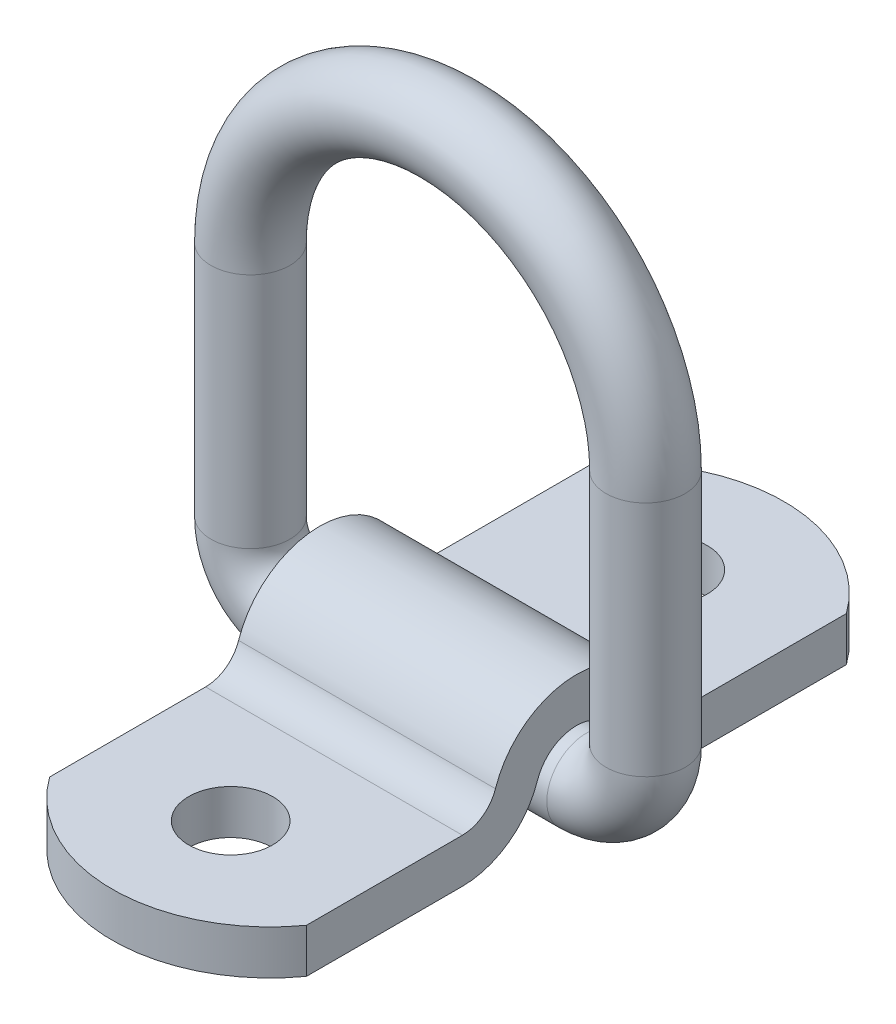
from build123d import *

# Parameters (mm, degrees)
SKETCH2_R           = 3.175
BOSS_EXTRUDE1_DEPTH = 10.31875
SKETCH4_R           = 3.3734375
CUT_EXTRUDE1_DEPTH  = 57.766087848


with BuildPart() as part:
    # Sweep1: sweep along a path in Sketch1
    with BuildLine(Plane.XY) as sweep1_path:
        Line((-15.875, 23.8125), (-15.875, 4.7625))
        ThreePointArc((-15.875, 4.7625), (-14.480096045, 1.394903955), (-11.1125, 0))
        Line((-11.1125, 0), (11.1125, 0))
        ThreePointArc((11.1125, 0), (14.480096045, 1.394903955), (15.875, 4.7625))
        Line((15.875, 4.7625), (15.875, 23.8125))
        ThreePointArc((15.875, 23.8125), (0, 39.6875), (-15.875, 23.8125))
    # Sketch2 → Sweep1 (sweep)
    with BuildSketch(Plane(origin=(0, 0, 0), x_dir=(0, 0, -1), z_dir=(1, 0, 0))):
        Circle(SKETCH2_R)
    sweep(path=sweep1_path.line)


with BuildPart() as body_2:
    # Sketch3 → Boss-Extrude1 (new, symmetric)
    with BuildSketch(Plane(origin=(0, 0, 0), x_dir=(0, 0, -1), z_dir=(1, 0, 0))):
        with BuildLine():
            Line((-26.9875, -3.302), (-26.9875, 0.254))
            Line((-26.9875, 0.254), (-9.15810024, 0.254))
            ThreePointArc((-9.15810024, 0.254), (-7.5238962, 0.781766747), (-6.507071223, 2.165684211))
            ThreePointArc((-6.507071223, 2.165684211), (0, 6.858), (6.507071223, 2.165684211))
            ThreePointArc((6.507071223, 2.165684211), (7.5238962, 0.781766747), (9.15810024, 0.254))
            Line((9.15810024, 0.254), (26.9875, 0.254))
            Line((26.9875, 0.254), (26.9875, -3.302))
            Line((26.9875, -3.302), (9.15810024, -3.302))
            ThreePointArc((9.15810024, -3.302), (5.44400015, -2.102530121), (3.133034293, 1.042736842))
            ThreePointArc((3.133034293, 1.042736842), (0, 3.302), (-3.133034293, 1.042736842))
            ThreePointArc((-3.133034293, 1.042736842), (-5.44400015, -2.102530121), (-9.15810024, -3.302))
            Line((-9.15810024, -3.302), (-26.9875, -3.302))
        make_face()
    extrude(amount=BOSS_EXTRUDE1_DEPTH, both=True)

    # Sketch4 → Cut-Extrude1 (cut, through all)
    with BuildSketch(Plane.XZ.offset(3.302)):
        with Locations(Location((0, 17.4625, 0), (0, 0, 270))):
            Circle(SKETCH4_R)
        with Locations(Location((0, -17.4625, 0), (0, 0, 270))):
            Circle(SKETCH4_R)
        with BuildLine():
            Line((-10.31875, 21.691107123), (-10.31875, 26.9875))
            Line((-10.31875, 26.9875), (-10.31875, 27.2415))
            Line((-10.31875, 27.2415), (10.31875, 27.2415))
            Line((10.31875, 27.2415), (10.31875, 26.9875))
            Line((10.31875, 26.9875), (10.31875, 21.691107123))
            ThreePointArc((10.31875, 21.691107123), (0, 26.9875), (-10.31875, 21.691107123))
        make_face()
        with BuildLine():
            Line((10.31875, -26.9875), (10.31875, -21.691107123))
            ThreePointArc((10.31875, -21.691107123), (0, -26.9875), (-10.31875, -21.691107123))
            Line((-10.31875, -21.691107123), (-10.31875, -26.9875))
            Line((-10.31875, -26.9875), (-10.31875, -27.2415))
            Line((-10.31875, -27.2415), (10.31875, -27.2415))
            Line((10.31875, -27.2415), (10.31875, -26.9875))
        make_face()
    extrude(amount=-CUT_EXTRUDE1_DEPTH, mode=Mode.SUBTRACT)


solid = Compound([part.part, body_2.part])
